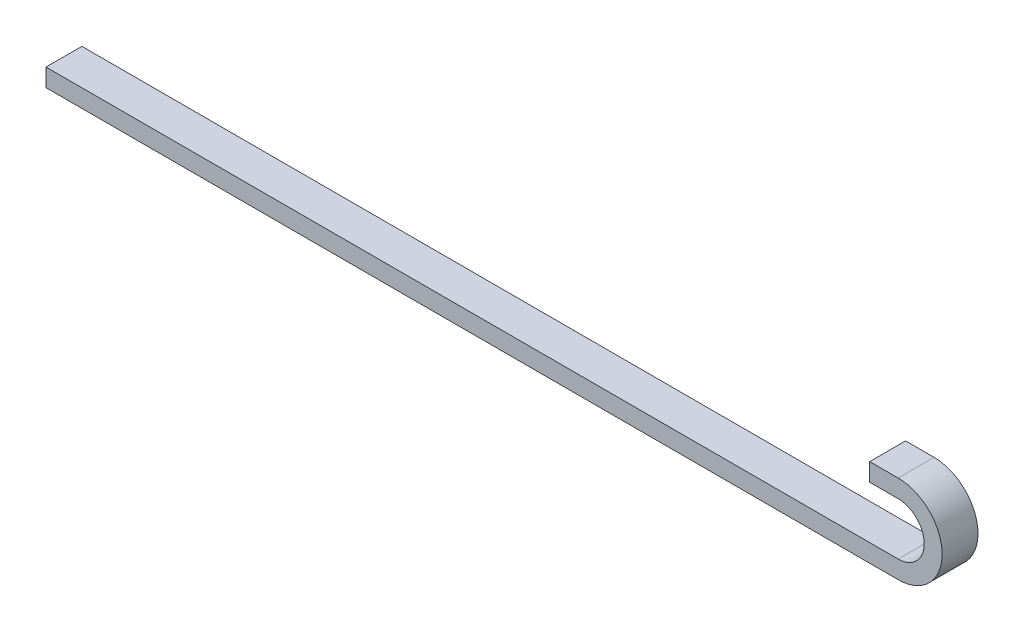
from build123d import *

# Parameters (mm, degrees)
BOSS_EXTRUDE1_DEPTH = 12.625


with BuildPart() as part:
    # Sketch1 → Boss-Extrude1 (new, symmetric)
    with BuildSketch(Plane.XY):
        with BuildLine():
            Line((-600, 0), (0, 0))
            ThreePointArc((0, 0), (31, 31), (0, 62))
            Line((0, 62), (-20, 62))
            Line((-20, 62), (-20, 49.4))
            Line((-20, 49.4), (0, 49.4))
            ThreePointArc((0, 49.4), (18.4, 31), (0, 12.6))
            Line((0, 12.6), (-600, 12.6))
            Line((-600, 12.6), (-600, 0))
        make_face()
    extrude(amount=BOSS_EXTRUDE1_DEPTH, both=True)


solid = part.part
